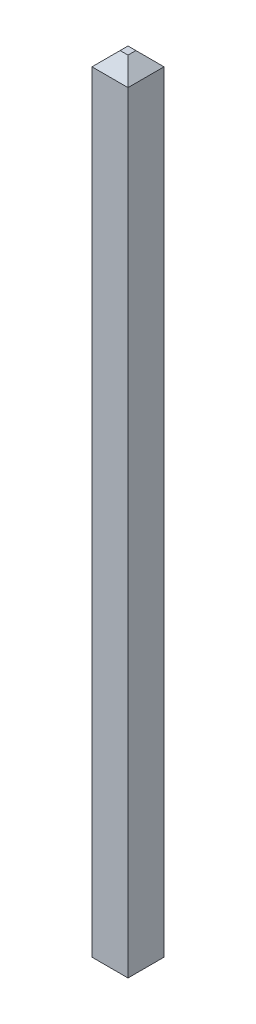
from build123d import *

# Parameters (mm, degrees)
SZKIC1_W                    = 0.64
SZKIC1_H                    = 0.64
DODANIE_WYCI_GNI_CIE1_DEPTH = 14.2
SFAZOWANIE1_SIZE            = 0.25
SFAZOWANIE2_SIZE            = 0.25


with BuildPart() as part:
    # Szkic1 → Dodanie-wyciągnięcie1 (new body)
    with BuildSketch(Plane(origin=(0, 0, 0), x_dir=(1, 0, 0), z_dir=(0, 1, 0))):
        Rectangle(SZKIC1_W, SZKIC1_H)
    extrude(amount=DODANIE_WYCI_GNI_CIE1_DEPTH)

    # Sfazowanie1
    sfazowanie1_edges = [part.edges().sort_by_distance(p)[0] for p in [
        (0.32, 14.2, 0),
        (0, 14.2, -0.32),
        (-0.32, 14.2, 0),
        (0, 14.2, 0.32),
    ]]
    chamfer(sfazowanie1_edges, length=SFAZOWANIE1_SIZE)

    # Sfazowanie2
    sfazowanie2_edges = [part.edges().sort_by_distance(p)[0] for p in [
        (0, 0, -0.32),
        (0.32, 0, 0),
        (0, 0, 0.32),
        (-0.32, 0, 0),
    ]]
    chamfer(sfazowanie2_edges, length=SFAZOWANIE2_SIZE)


solid = part.part
